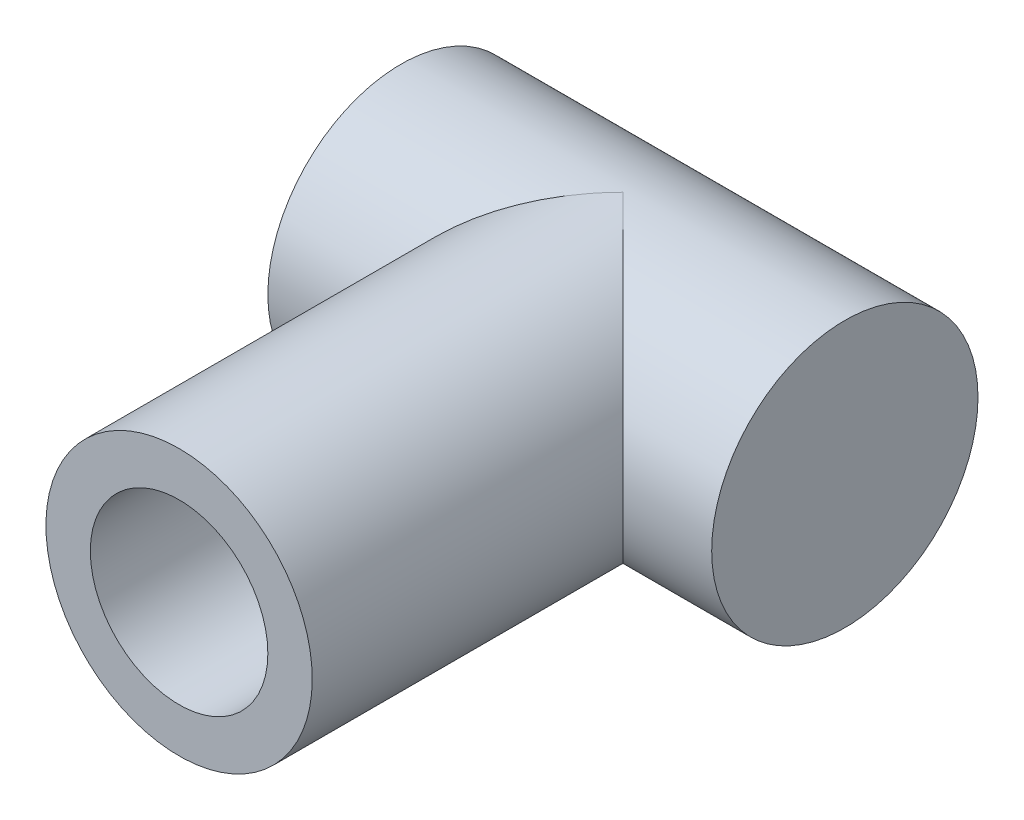
from build123d import *

# Parameters (mm, degrees)
SKETCH1_R           = 75
BOSS_EXTRUDE1_DEPTH = 125
SKETCH2_R           = 75
BOSS_EXTRUDE2_DEPTH = 250
SKETCH3_R           = 50
CUT_EXTRUDE1_DEPTH  = 150


with BuildPart() as part:
    # Sketch1 → Boss-Extrude1 (new, symmetric)
    with BuildSketch(Plane(origin=(0, 0, 0), x_dir=(0, 0, -1), z_dir=(1, 0, 0))):
        Circle(SKETCH1_R)
    extrude(amount=BOSS_EXTRUDE1_DEPTH, both=True)

    # Sketch2 → Boss-Extrude2 (add)
    with BuildSketch(Plane.XY):
        with Locations(Location((0, 0, 0), (0, 0, 90))):
            Circle(SKETCH2_R)
    extrude(amount=BOSS_EXTRUDE2_DEPTH)

    # Sketch3 → Cut-Extrude1 (cut)
    with BuildSketch(Plane.XY.offset(250)):
        Circle(SKETCH3_R)
    extrude(amount=-CUT_EXTRUDE1_DEPTH, mode=Mode.SUBTRACT)


solid = part.part
